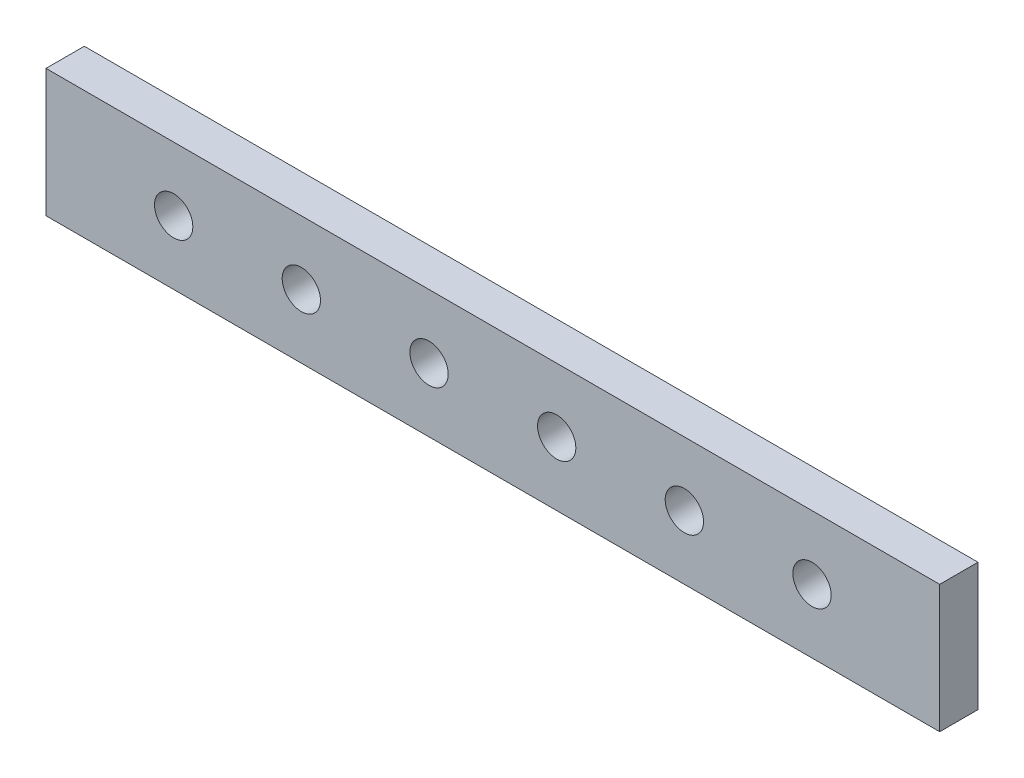
from build123d import *

# Parameters (mm, degrees)
SKETCH1_W           = 70
SKETCH1_H           = 10
SKETCH1_R           = 1.5
BOSS_EXTRUDE1_DEPTH = 3


with BuildPart() as part:
    # Sketch1 → Boss-Extrude1 (new body)
    with BuildSketch(Plane.XY):
        Rectangle(SKETCH1_W, SKETCH1_H)
        with Locations((-25, 0)):
            Circle(SKETCH1_R, mode=Mode.SUBTRACT)
        with Locations((-15, 0)):
            Circle(SKETCH1_R, mode=Mode.SUBTRACT)
        with Locations((-5, 0)):
            Circle(SKETCH1_R, mode=Mode.SUBTRACT)
        with Locations((5, 0)):
            Circle(SKETCH1_R, mode=Mode.SUBTRACT)
        with Locations((15, 0)):
            Circle(SKETCH1_R, mode=Mode.SUBTRACT)
        with Locations((25, 0)):
            Circle(SKETCH1_R, mode=Mode.SUBTRACT)
    extrude(amount=BOSS_EXTRUDE1_DEPTH)


solid = part.part
